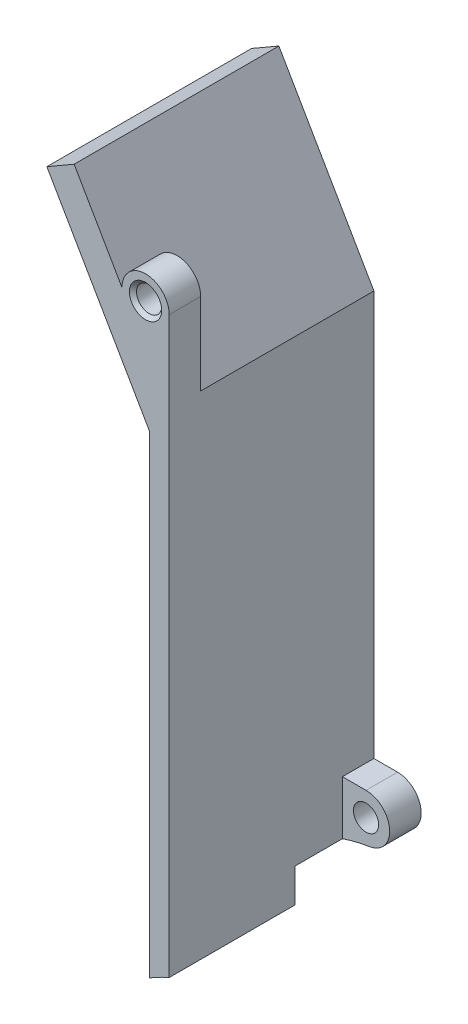
from build123d import *

# Parameters (mm, degrees)
EXTRUDE_START                = -2
EXTRUDE_1_DEPTH              = 13
SKETCH_2_R                   = 11
CUT_EXTRUDE_1_DEPTH          = 5
SKETCH_3_R                   = 1.5
EXTRUDE_2_DEPTH              = 2
EXTRUDE_3_DEPTH              = 2
HOLE_WIZARD_M2_4_D           = 1.6
HOLE_WIZARD_M2_4_DEPTH       = 5.2
HOLE_WIZARD_M2_4_CSINK_D     = 2.05
HOLE_WIZARD_M2_4_CSINK_ANGLE = 90
HOLE_WIZARD_M2_4_TIP         = 0.480688495
HOLE_WIZARD_M2_5_D           = 1.6
HOLE_WIZARD_M2_5_DEPTH       = 5.2
HOLE_WIZARD_M2_5_CSINK_D     = 2.05
HOLE_WIZARD_M2_5_CSINK_ANGLE = 90
HOLE_WIZARD_M2_5_TIP         = 0.480688495


with BuildPart() as part:
    # 草图1 → 凸台-拉伸1 (new body)
    with BuildSketch(Plane.XY.offset(EXTRUDE_START)):
        with BuildLine():
            Line((2.570888862, -12.45291013), (-3.464101615, -2))
            Line((-3.464101615, -2), (-5.196152423, -3))
            Line((-5.196152423, -3), (1.320888862, -14.287846621))
            Line((1.320888862, -14.287846621), (1.320888862, -44.355557574))
            ThreePointArc((1.320888862, -44.355557574), (1.933218512, -44.007523283), (2.570888862, -43.708438024))
            Line((2.570888862, -43.708438024), (2.570888862, -12.45291013))
        make_face()
    extrude(amount=-EXTRUDE_1_DEPTH)

    # 草图2 → 切除-拉伸1 (cut)
    with BuildSketch(Plane(origin=(0, 0, -15), x_dir=(-1, 0, 0), z_dir=(0, 0, -1))):
        with Locations((-6.070888862, -52)):
            Circle(SKETCH_2_R)
    extrude(amount=-CUT_EXTRUDE_1_DEPTH, mode=Mode.SUBTRACT)

    # 草图3 → 凸台-拉伸2 (add)
    with BuildSketch(Plane(origin=(0, 0, -15), x_dir=(-1, 0, 0), z_dir=(0, 0, -1))):
        with Locations((-4.070888862, -39.661037321)):
            Circle(SKETCH_3_R)
        with BuildLine():
            Line((-2.570888862, -41.571673193), (-2.570888862, -39.661037321))
            ThreePointArc((-2.570888862, -39.661037321), (-3.098777733, -40.803403266), (-4.310888798, -41.141712853))
            ThreePointArc((-4.310888798, -41.141712853), (-3.432117057, -41.321194666), (-2.570888862, -41.571673193))
        make_face()
        with BuildLine():
            Line((-2.570888862, -39.661037321), (-2.570888862, -38.161037321))
            Line((-2.570888862, -38.161037321), (-4.070888862, -38.161037321))
            ThreePointArc((-4.070888862, -38.161037321), (-3.010228691, -38.600377149), (-2.570888862, -39.661037321))
        make_face()
    extrude(amount=-EXTRUDE_2_DEPTH)

    # 草图4 → 凸台-拉伸3 (add)
    with BuildSketch(Plane.XY.offset(-2)):
        with BuildLine():
            Line((0.320888862, -8.555795813), (2.570888862, -12.45291013))
            Line((2.570888862, -12.45291013), (2.570888862, -7.256757708))
            ThreePointArc((2.570888862, -7.256757708), (1.820888862, -8.555795813), (0.320888862, -8.555795813))
        make_face()
        with BuildLine():
            ThreePointArc((0.320888862, -8.555795813), (1.820888862, -8.555795813), (2.570888862, -7.256757708))
            Line((2.570888862, -7.256757708), (-0.429111138, -7.256757708))
            Line((-0.429111138, -7.256757708), (0.320888862, -8.555795813))
        make_face()
        with BuildLine():
            Line((-0.429111138, -7.256757708), (2.570888862, -7.256757708))
            ThreePointArc((2.570888862, -7.256757708), (1.070888862, -5.756757708), (-0.429111138, -7.256757708))
        make_face()
    extrude(amount=-EXTRUDE_3_DEPTH)

    # M2 螺纹孔4
    with Locations(Plane.XY.offset(-2)):
        with Locations((1.070888862, -7.256757708)):
            CounterSinkHole(HOLE_WIZARD_M2_4_D / 2, HOLE_WIZARD_M2_4_CSINK_D / 2, depth=HOLE_WIZARD_M2_4_DEPTH, counter_sink_angle=HOLE_WIZARD_M2_4_CSINK_ANGLE)
            with Locations((0, 0, -(HOLE_WIZARD_M2_4_DEPTH + HOLE_WIZARD_M2_4_TIP / 2))):  # 118° drill point
                Cone(0, HOLE_WIZARD_M2_4_D / 2, HOLE_WIZARD_M2_4_TIP, mode=Mode.SUBTRACT)

    # M2 螺纹孔5
    with Locations(Plane(origin=(0, 0, -15), x_dir=(-1, 0, 0), z_dir=(0, 0, -1))):
        with Locations((-4.070888862, -39.661037321)):
            CounterSinkHole(HOLE_WIZARD_M2_5_D / 2, HOLE_WIZARD_M2_5_CSINK_D / 2, depth=HOLE_WIZARD_M2_5_DEPTH, counter_sink_angle=HOLE_WIZARD_M2_5_CSINK_ANGLE)
            with Locations((0, 0, -(HOLE_WIZARD_M2_5_DEPTH + HOLE_WIZARD_M2_5_TIP / 2))):  # 118° drill point
                Cone(0, HOLE_WIZARD_M2_5_D / 2, HOLE_WIZARD_M2_5_TIP, mode=Mode.SUBTRACT)


solid = part.part
